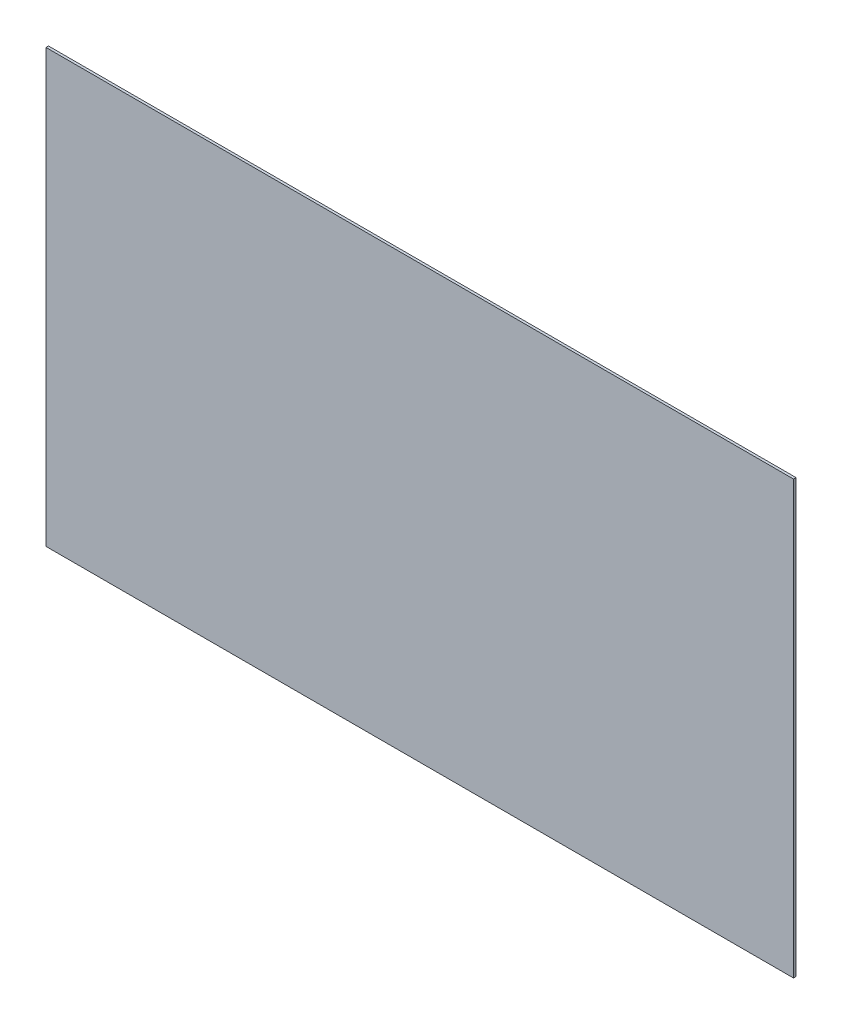
from build123d import *

# Parameters (mm, degrees)
SKETCH1_W           = 296.98
SKETCH1_H           = 171.7
BOSS_EXTRUDE1_DEPTH = 1


with BuildPart() as part:
    # Sketch1 → Boss-Extrude1 (new body)
    with BuildSketch(Plane.XY):
        Rectangle(SKETCH1_W, SKETCH1_H)
    extrude(amount=BOSS_EXTRUDE1_DEPTH)


solid = part.part
